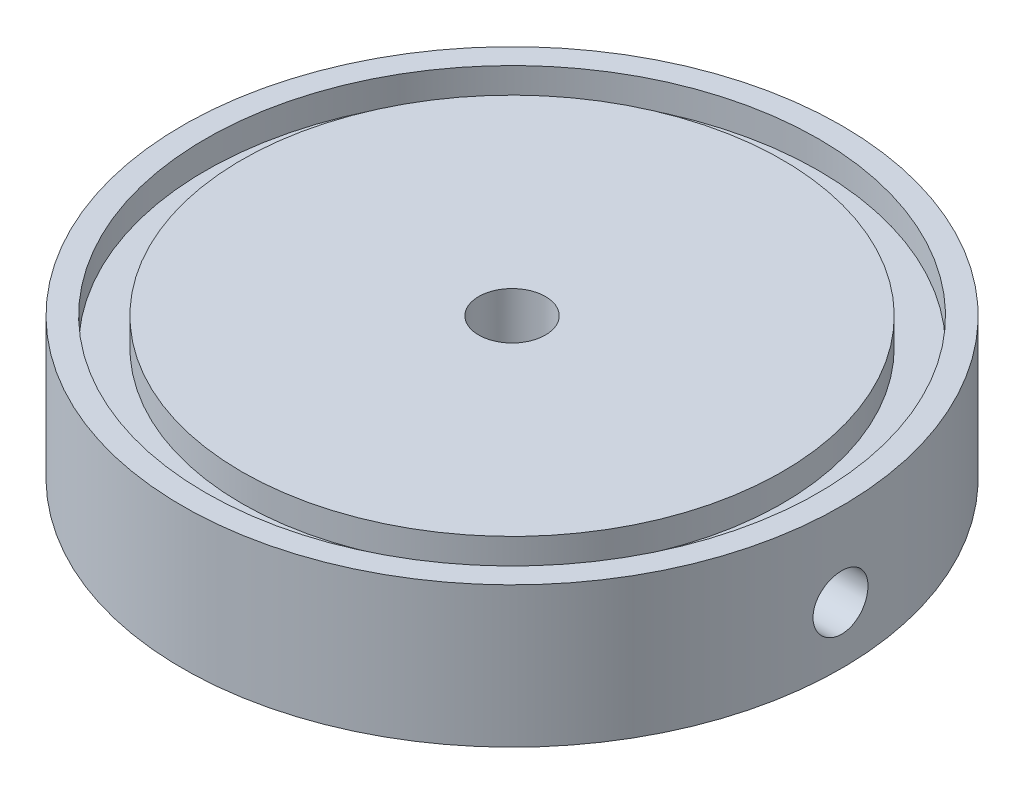
from build123d import *

# Parameters (mm, degrees)
SKETCH2_R          = 1.7272
CUT_EXTRUDE1_DEPTH = 55.61
SKETCH3_R          = 35.433
SKETCH3_R_2        = 31.242
CUT_EXTRUDE2_DEPTH = 3.175
SKETCH4_R          = 1.03251
CUT_EXTRUDE3_DEPTH = 3.175
CIRPATTERN1_COUNT  = 9
SKETCH5_R          = 3.175
CUT_EXTRUDE4_DEPTH = 9.525
FILLET1_R          = 1.27


with BuildPart() as part:
    # Sketch1 → Revolve1 (revolve)
    with BuildSketch(Plane.XY):
        with BuildLine():
            Line((3.8608, 7.366), (38.1, 7.366))
            Line((38.1, 7.366), (38.1, -8.89))
            Line((38.1, -8.89), (22.6695, -8.89))
            Line((22.6695, -8.89), (22.6695, -7.874))
            Line((22.6695, -7.874), (21.1455, -7.874))
            Line((21.1455, -7.874), (21.1455, -8.89))
            Line((21.1455, -8.89), (10.9855, -8.89))
            Line((10.9855, -8.89), (10.9855, -6.391948453))
            ThreePointArc((10.9855, -6.391948453), (10.570616467, -5.000733157), (9.4615, -4.064))
            Line((9.4615, -4.064), (3.8608, 0))
            Line((3.8608, 0), (3.8608, 7.366))
        make_face()
    revolve(axis=Axis((0, 101.60464546, 0), (0, 1, 0)))

    # Sketch2 → Cut-Extrude1 (cut, through all)
    with BuildSketch(Plane(origin=(0, 0, 0), x_dir=(0, 0, -1), z_dir=(1, 0, 0))):
        with Locations((0, -2.286)):
            Circle(SKETCH2_R)
    extrude(amount=CUT_EXTRUDE1_DEPTH, mode=Mode.SUBTRACT)

    # Sketch3 → Cut-Extrude2 (cut)
    with BuildSketch(Plane(origin=(0, 7.366, 0), x_dir=(1, 0, 0), z_dir=(0, 1, 0))):
        Circle(SKETCH3_R)
        Circle(SKETCH3_R_2, mode=Mode.SUBTRACT)
    extrude(amount=-CUT_EXTRUDE2_DEPTH, mode=Mode.SUBTRACT)

    # Sketch4 → Cut-Extrude3 (cut)
    with BuildSketch(Plane(origin=(0, -8.89, 0), x_dir=(-1, 0, 0), z_dir=(0, -1, 0))):
        with Locations((-13.97, 24.196749782)):
            Circle(SKETCH4_R)
    cut_extrude3 = extrude(amount=-CUT_EXTRUDE3_DEPTH, mode=Mode.SUBTRACT)

    # CirPattern1: Cut-Extrude3 ×9 about axis
    cirpattern1_axis = Axis((0, 7.366, 0), (0, -1, 0))
    for i in range(1, CIRPATTERN1_COUNT):
        add(cut_extrude3.rotate(cirpattern1_axis, i * 360 / CIRPATTERN1_COUNT), mode=Mode.SUBTRACT)

    # Sketch5 → Cut-Extrude4 (cut)
    with BuildSketch(Plane(origin=(38.1, 0, 0), x_dir=(0, 0, -1), z_dir=(1, 0, 0))):
        with Locations((0, -2.286)):
            Circle(SKETCH5_R)
    extrude(amount=-CUT_EXTRUDE4_DEPTH, mode=Mode.SUBTRACT)

    # Fillet1
    fillet1_edges = [part.edges().sort_by_distance(p)[0] for p in [
        (-3.8608, 0, 0),
    ]]
    fillet(fillet1_edges, radius=FILLET1_R)


solid = part.part
